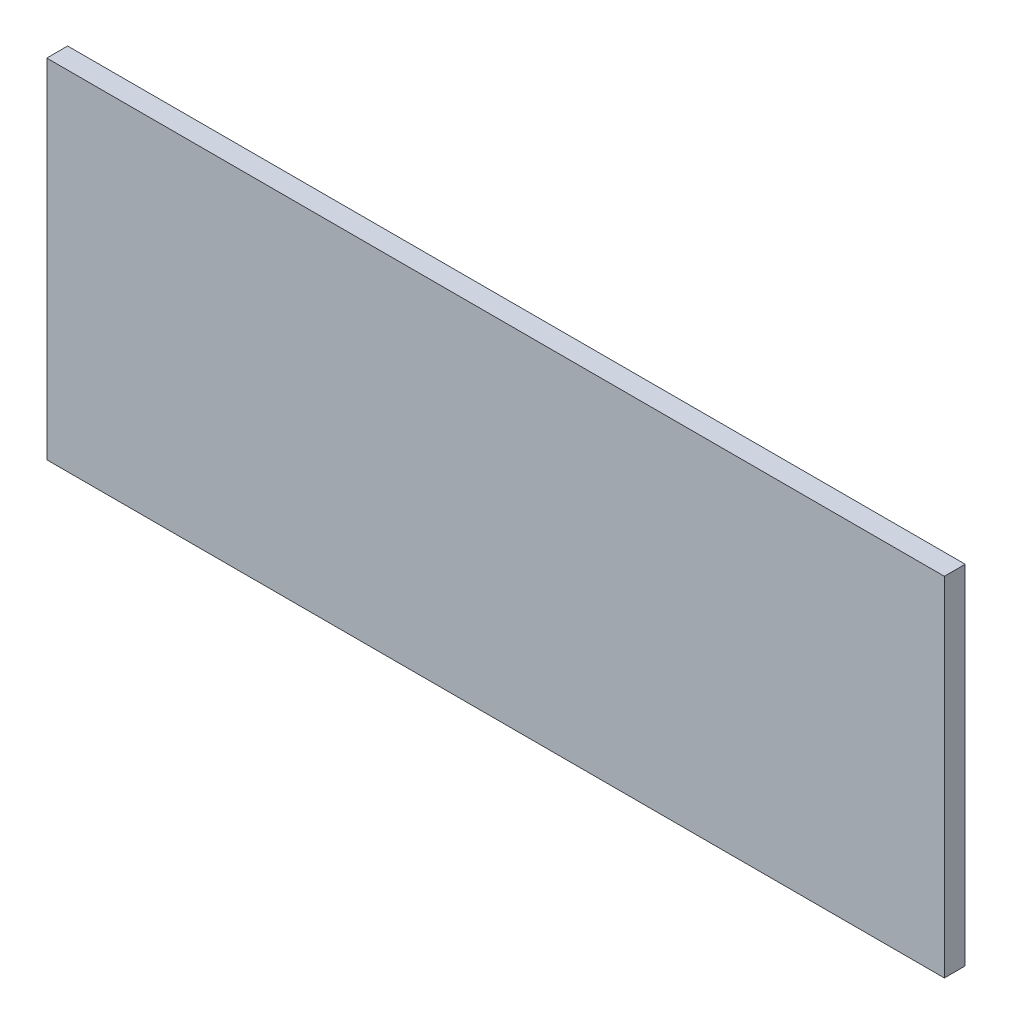
from build123d import *

# Parameters (mm, degrees)
ESBO_O1_W                = 258
ESBO_O1_H                = 100
RESSALTO_EXTRUS_O1_DEPTH = 6


with BuildPart() as part:
    # Esboço1 → Ressalto-extrusão1 (new body)
    with BuildSketch(Plane.XY):
        with Locations((-129, 50)):
            Rectangle(ESBO_O1_W, ESBO_O1_H)
    extrude(amount=RESSALTO_EXTRUS_O1_DEPTH)


solid = part.part
